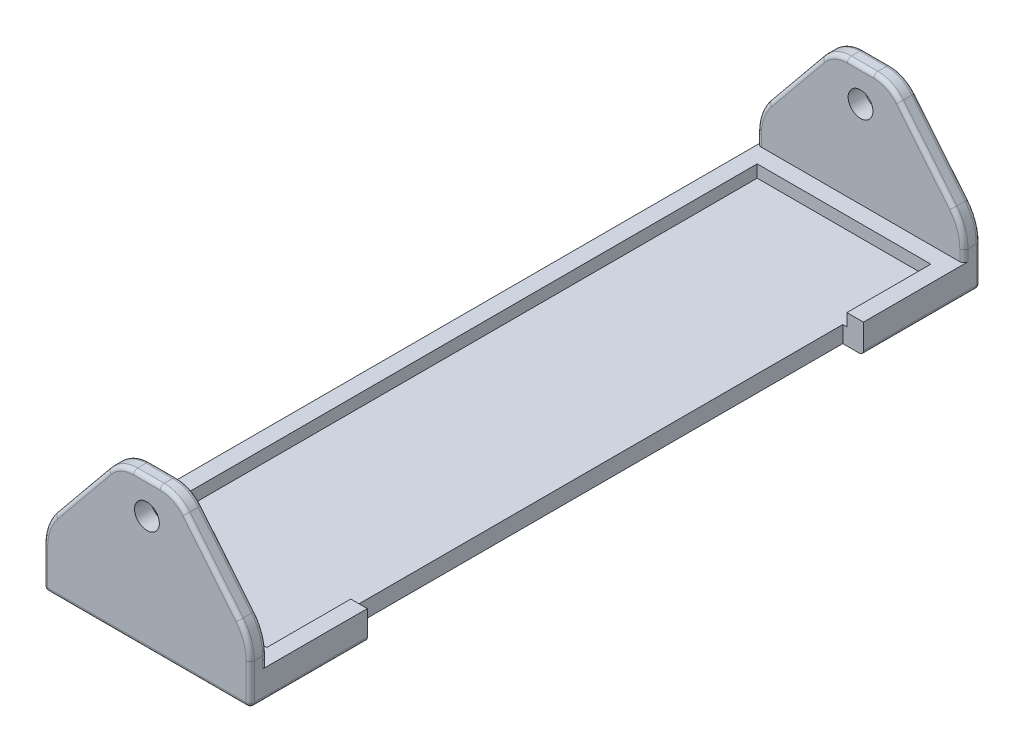
from build123d import *

# Parameters (mm, degrees)
SKETCH_1_W          = 25
SKETCH_1_H          = 3.5
EXTRUDE_1_DEPTH     = 84.3
SHELL_1_T           = -2
SKETCH_2_W          = 2.5
SKETCH_2_H          = 60
CUT_EXTRUDE_1_DEPTH = 88.998522715
EXTRUDE_2_DEPTH     = 2
EXTRUDE_3_DEPTH     = 2
SKETCH_5_R          = 1.5
CUT_EXTRUDE_2_DEPTH = 94.519463215
FILLET_1_R          = 4
FILLET_2_R          = 6
FILLET_3_R          = 0.5
FILLET_4_R          = 0.5


with BuildPart() as part:
    # 草图1 → 凸台-拉伸1 (new body)
    with BuildSketch(Plane.XY):
        with Locations((12.5, 1.75)):
            Rectangle(SKETCH_1_W, SKETCH_1_H)
    extrude(amount=EXTRUDE_1_DEPTH)

    # 抽壳1
    shell_1_openings = [part.faces().sort_by_distance(p)[0] for p in [
        (12.5, 3.5, 42.15),
    ]]
    offset(amount=SHELL_1_T, openings=shell_1_openings, kind=Kind.INTERSECTION)

    # 草图2 → 切除-拉伸1 (cut, through all)
    with BuildSketch(Plane.XZ):
        with Locations((23.75, 42.15)):
            Rectangle(SKETCH_2_W, SKETCH_2_H)
    extrude(amount=-CUT_EXTRUDE_1_DEPTH, mode=Mode.SUBTRACT)

    # 草图3 → 凸台-拉伸2 (add)
    with BuildSketch(Plane(origin=(0, 0, 0), x_dir=(-1, 0, 0), z_dir=(0, 0, -1))):
        Polygon((-25, 7), (-16, 18), (-9, 18), (0, 7), (0, 0), (-25, 0), align=None)
    extrude(amount=EXTRUDE_2_DEPTH)

    # 草图4 → 凸台-拉伸3 (add)
    with BuildSketch(Plane.XY.offset(84.3)):
        Polygon((0, 0), (0, 7), (9, 18), (16, 18), (25, 7), (25, 0), align=None)
    extrude(amount=EXTRUDE_3_DEPTH)

    # 草图5 → 切除-拉伸2 (cut, through all)
    with BuildSketch(Plane.XY.offset(86.3)):
        with Locations((12.5, 14)):
            Circle(SKETCH_5_R)
    extrude(amount=-CUT_EXTRUDE_2_DEPTH, mode=Mode.SUBTRACT)

    # 圆角1
    fillet_1_edges = [part.edges().sort_by_distance(p)[0] for p in [
        (9, 18, -1),
        (16, 18, -1),
        (16, 18, 85.3),
        (9, 18, 85.3),
    ]]
    fillet(fillet_1_edges, radius=FILLET_1_R)

    # 圆角2
    fillet_2_edges = [part.edges().sort_by_distance(p)[0] for p in [
        (25, 7, -1),
        (0, 7, -1),
        (25, 7, 85.3),
        (0, 7, 85.3),
    ]]
    fillet(fillet_2_edges, radius=FILLET_2_R)

    # 圆角3
    fillet_3_edges = [part.edges().sort_by_distance(p)[0] for p in [
        (4.577971759, 12.595298817, 86.3),
        (9.182595707, 17.61467873, 86.3),
        (15.817404293, 17.61467873, 86.3),
        (0, 2.429109865, 86.3),
        (0, 4.179109865, 84.3),
        (20.422028241, 12.595298817, 84.3),
        (24.650772636, 6.87533862, 84.3),
        (0.349227364, 6.87533862, 84.3),
        (20.422028241, 12.595298817, 86.3),
        (24.650772636, 6.87533862, 86.3),
        (0.349227364, 6.87533862, 86.3),
        (25, 2.429109865, -2),
        (25, 4.179109865, 0),
        (4.577971759, 12.595298817, 0),
        (0.349227364, 6.87533862, 0),
        (24.650772636, 6.87533862, 0),
        (4.577971759, 12.595298817, -2),
        (0.349227364, 6.87533862, -2),
        (24.650772636, 6.87533862, -2),
        (0, 4.179109865, 0),
        (0, 2.429109865, -2),
        (25, 4.179109865, 84.3),
        (25, 2.429109865, 86.3),
        (20.422028241, 12.595298817, 0),
        (20.422028241, 12.595298817, -2),
        (12.5, 18, 0),
        (9.182595707, 17.61467873, 0),
        (15.817404293, 17.61467873, 0),
        (12.5, 18, -2),
        (9.182595707, 17.61467873, -2),
        (15.817404293, 17.61467873, -2),
        (12.5, 18, 84.3),
        (12.5, 18, 86.3),
        (4.577971759, 12.595298817, 84.3),
        (9.182595707, 17.61467873, 84.3),
        (15.817404293, 17.61467873, 84.3),
    ]]
    fillet(fillet_3_edges, radius=FILLET_3_R)

    # 圆角4
    fillet_4_edges = [part.edges().sort_by_distance(p)[0] for p in [
        (25, 0, 78.975),
        (24.853553391, 0, -1.853553391),
        (12.5, 0, -2),
        (0.146446609, 0, -1.853553391),
        (0, 0, 42.15),
        (0.146446609, 0, 86.153553391),
        (24.853553391, 0, 86.153553391),
        (12.5, 0, 86.3),
    ]]
    fillet(fillet_4_edges, radius=FILLET_4_R)


solid = part.part
